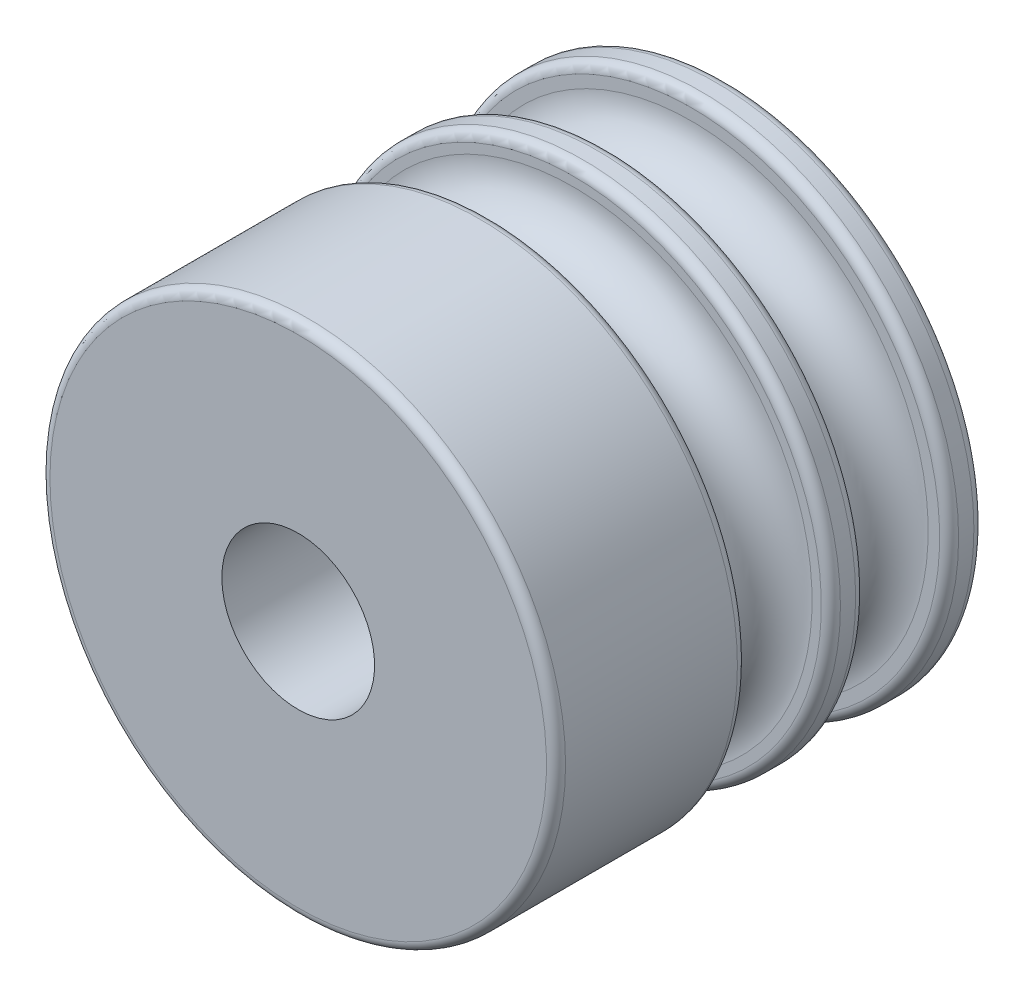
from build123d import *


with BuildPart() as part:
    # Sketch1 → Revolve1 (revolve)
    with BuildSketch(Plane(origin=(0, 0, 0), x_dir=(1, 0, 0), z_dir=(0, 1, 0)), mode=Mode.PRIVATE) as revolve1_sk:
        with BuildLine():
            Line((-44.051280268, 12.453134186), (-43.556301458, 12.453134186))
            ThreePointArc((-43.556301458, 12.453134186), (-43.202748067, 12.306687577), (-43.056301458, 11.953134186))
            Line((-43.056301458, 11.953134186), (-43.056301458, 2.953134186))
            ThreePointArc((-43.056301458, 2.953134186), (-43.202748067, 2.599580796), (-43.556301458, 2.453134186))
            Line((-43.556301458, 2.453134186), (-52.556301458, 2.453134186))
            Line((-52.556301458, 2.453134186), (-52.556301458, 24.843765287))
            Line((-52.556301458, 24.843765287), (-45.853357733, 24.843765287))
            Line((-45.853357733, 24.843765287), (-43.556233845, 24.843765287))
            ThreePointArc((-43.556233845, 24.843765287), (-43.199785241, 24.694399559), (-43.056301458, 24.335542858))
            Line((-43.056301458, 24.335542858), (-43.056301458, 23.535542858))
            ThreePointArc((-43.056301458, 23.535542858), (-43.205599573, 23.187316683), (-43.556233845, 23.043765287))
            Line((-43.556233845, 23.043765287), (-44.156000386, 23.043765287))
            ThreePointArc((-44.156000386, 23.043765287), (-46.356000386, 20.843765287), (-44.156000386, 18.643765287))
            Line((-44.156000386, 18.643765287), (-43.556301458, 18.643765287))
            ThreePointArc((-43.556301458, 18.643765287), (-43.202748067, 18.497318677), (-43.056301458, 18.143765287))
            Line((-43.056301458, 18.143765287), (-43.056301458, 17.347547208))
            ThreePointArc((-43.056301458, 17.347547208), (-43.202748067, 16.993993818), (-43.556301458, 16.847547208))
            Line((-43.556301458, 16.847547208), (-44.039378718, 16.847547208))
            ThreePointArc((-44.039378718, 16.847547208), (-46.355992318, 14.65659875), (-44.051280268, 12.453134186))
        make_face()
    revolve(revolve1_sk.sketch.rotate(Axis((-56.556301458, 0, -55.278342432), (0, 0, 1)), 180), axis=Axis((-56.556301458, 0, -55.278342432), (0, 0, 1)))


solid = part.part
